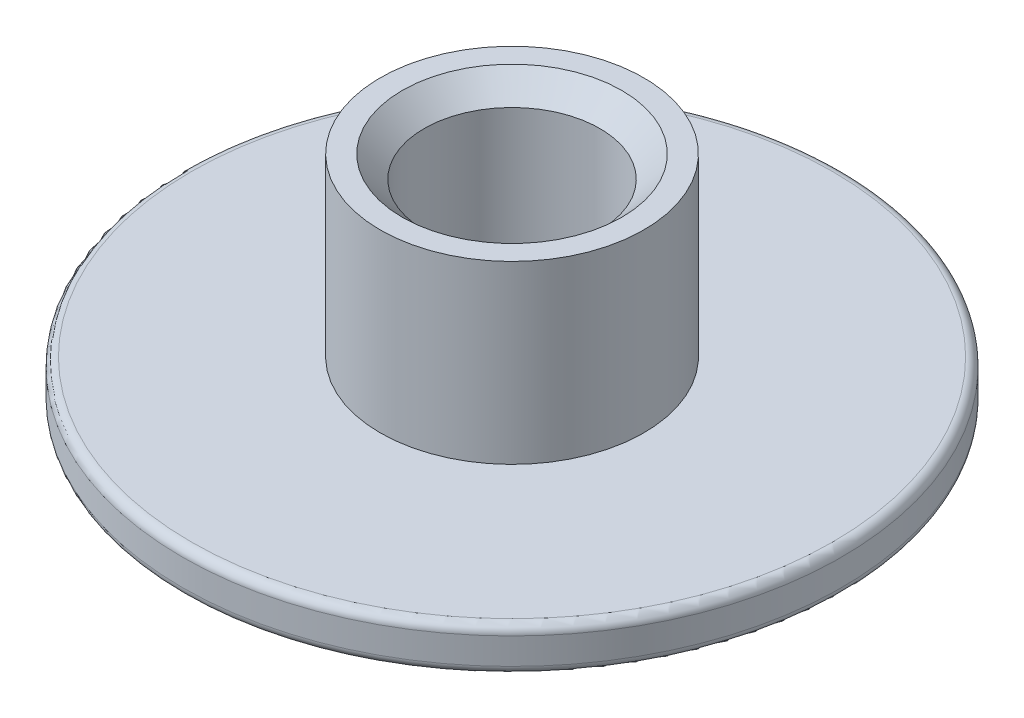
from build123d import *

# Parameters (mm, degrees)
SKETCH_1_R          = 7.5
EXTRUDE_1_DEPTH     = 1
SKETCH_2_R          = 3
EXTRUDE_2_DEPTH     = 4
CUT_EXTRUDE_1_REACH = 13.726
SKETCH_3_R          = 2
CHAMFER_1_SIZE      = 0.5
FILLET_1_R          = 0.2


with BuildPart() as part:
    # 草图1 → 凸台-拉伸1 (new body)
    with BuildSketch(Plane(origin=(0, 0, 0), x_dir=(1, 0, 0), z_dir=(0, 1, 0))):
        with Locations(Location((0, 0, 0), (0, 0, 270))):
            Circle(SKETCH_1_R)
    extrude(amount=EXTRUDE_1_DEPTH)

    # 草图2 → 凸台-拉伸2 (add)
    with BuildSketch(Plane(origin=(0, 1, 0), x_dir=(1, 0, 0), z_dir=(0, 1, 0))):
        with Locations(Location((0, 0, 0), (0, 0, 270))):
            Circle(SKETCH_2_R)
    extrude(amount=EXTRUDE_2_DEPTH)

    # 草图3 → 切除-拉伸1 (cut, up to next)
    with BuildSketch(Plane(origin=(0, 5, 0), x_dir=(1, 0, 0), z_dir=(0, 1, 0)), mode=Mode.PRIVATE) as cut_extrude_1_sk1:
        with Locations(Location((0, 0, 0), (0, 0, 270))):
            Circle(SKETCH_3_R)
    cut_extrude_1_tool1 = extrude(cut_extrude_1_sk1.sketch, amount=-CUT_EXTRUDE_1_REACH, mode=Mode.PRIVATE) & part.part
    add(cut_extrude_1_tool1.solids().sort_by_distance((0, 5, 0))[0], mode=Mode.SUBTRACT)

    # 倒角1
    chamfer_1_edges = [part.edges().sort_by_distance(p)[0] for p in [
        (0, 5, -2),
        (0, 0, -2),
    ]]
    chamfer(chamfer_1_edges, length=CHAMFER_1_SIZE)

    # 圆角1
    fillet_1_edges = [part.edges().sort_by_distance(p)[0] for p in [
        (0, 0, -7.5),
        (0, 1, -7.5),
    ]]
    fillet(fillet_1_edges, radius=FILLET_1_R)


solid = part.part
